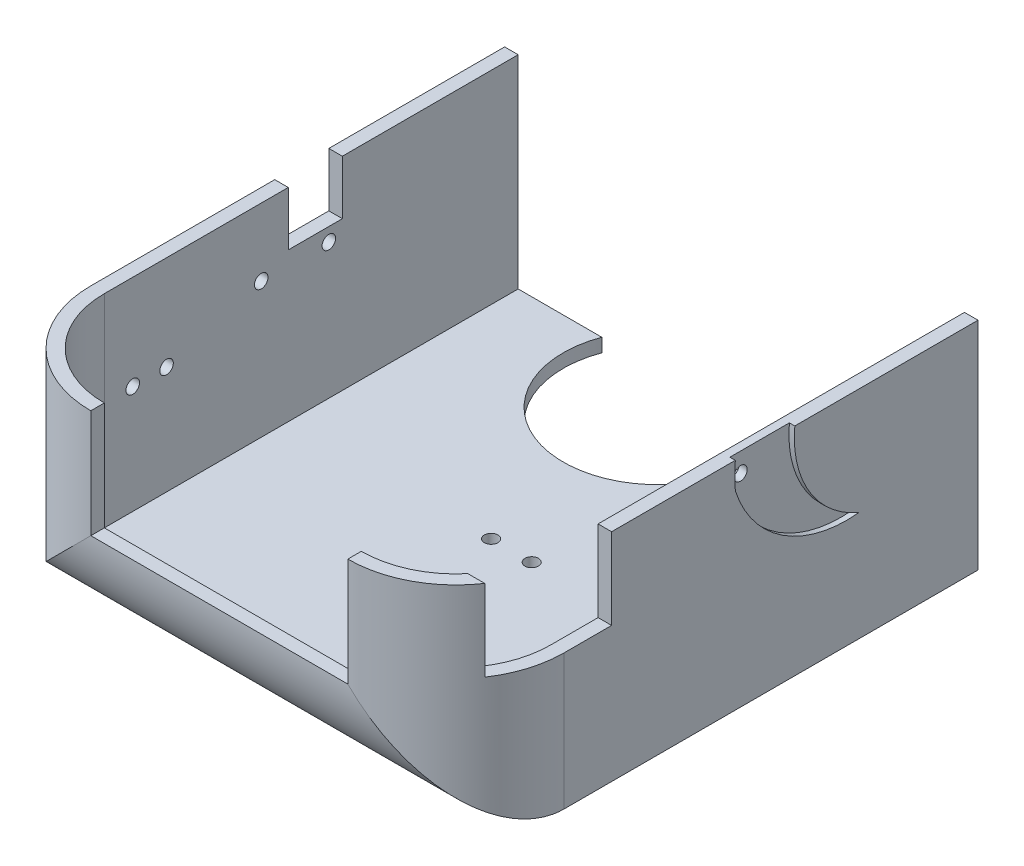
from build123d import *

# Parameters (mm, degrees)
SKETCH_1_W           = 175
SKETCH_1_H           = 160
EXTRUDE_1_DEPTH      = 193
FILLET_8_R           = 40
SHELL_2_T            = -5
SKETCH_9_W           = 95
SKETCH_9_H           = 80
CUT_EXTRUDE_3_DEPTH  = 10
SKETCH_10_R          = 35
CUT_EXTRUDE_4_DEPTH  = 160
SKETCH_12_W          = 40
SKETCH_12_H          = 60
CUT_EXTRUDE_5_DEPTH  = 20
CUT_EXTRUDE_6_DEPTH  = 80
SKETCH_15_R          = 2.5
CUT_EXTRUDE_8_DEPTH  = 5
SKETCH_17_R          = 2.5
SKETCH_17_W          = 20
SKETCH_17_H          = 20
CUT_EXTRUDE_10_DEPTH = 5
CUT_EXTRUDE_11_DEPTH = 2
SKETCH_20_R          = 2.5
CUT_EXTRUDE_13_DEPTH = 5


with BuildPart() as part:
    # 草圖1 → 填料-伸長1 (new body)
    with BuildSketch(Plane.XY):
        Rectangle(SKETCH_1_W, SKETCH_1_H)
    extrude(amount=EXTRUDE_1_DEPTH)

    # 圓角8
    fillet_8_edges = [part.edges().sort_by_distance(p)[0] for p in [
        (-87.5, 0, 193),
        (0, -80, 193),
        (87.5, 0, 193),
        (0, 80, 193),
    ]]
    fillet(fillet_8_edges, radius=FILLET_8_R)

    # 薄殼2
    shell_2_openings = [part.faces().sort_by_distance(p)[0] for p in [
        (0, 0, 0),
    ]]
    offset(amount=SHELL_2_T, openings=shell_2_openings)

    # 草圖9 → 除料-伸長3 (cut)
    with BuildSketch(Plane.XY.offset(193)):
        Rectangle(SKETCH_9_W, SKETCH_9_H)
    extrude(amount=-CUT_EXTRUDE_3_DEPTH, mode=Mode.SUBTRACT)

    # 草圖10 → 除料-伸長4 (cut)
    with BuildSketch(Plane(origin=(0, 80, 0), x_dir=(1, 0, 0), z_dir=(0, 1, 0))):
        with Locations((-18.75, -12.103072957)):
            Circle(SKETCH_10_R)
    extrude(amount=-CUT_EXTRUDE_4_DEPTH, mode=Mode.SUBTRACT)

    # 草圖12 → 除料-伸長5 (cut)
    with BuildSketch(Plane(origin=(90, 0, 0), x_dir=(0, 0, -1), z_dir=(1, 0, 0))):
        with Locations((-155.457670656, 0)):
            Rectangle(SKETCH_12_W, SKETCH_12_H)
    extrude(amount=-CUT_EXTRUDE_5_DEPTH, mode=Mode.SUBTRACT)

    # 草圖4 → 除料-伸長6 (cut)
    with BuildSketch(Plane(origin=(0, 0, 0), x_dir=(1, 0, 0), z_dir=(0, 1, 0))):
        Polygon((0, -200), (-165, -200), (-165, 0), (110, 0), (110, -200), align=None)
    extrude(amount=CUT_EXTRUDE_6_DEPTH, mode=Mode.SUBTRACT)

    # 草圖15 → 除料-伸長8 (cut)
    with BuildSketch(Plane(origin=(0, -80, 0), x_dir=(1, 0, 0), z_dir=(0, 1, 0))):
        with Locations(Location((-7.5, -85, 0), (0, 0, 270))):
            Circle(SKETCH_15_R)
        with Locations(Location((7.5, -85, 0), (0, 0, 270))):
            Circle(SKETCH_15_R)
    extrude(amount=CUT_EXTRUDE_8_DEPTH, mode=Mode.SUBTRACT)

    # 草圖17 → 除料-伸長10 (cut)
    with BuildSketch(Plane.ZY.offset(87.5)):
        with Locations((130, -35)):
            Circle(SKETCH_17_R)
        with Locations((142.5, -35)):
            Circle(SKETCH_17_R)
        with Locations((70, -25)):
            Circle(SKETCH_17_R)
        with Locations((95, -25)):
            Circle(SKETCH_17_R)
        with Locations((75, -10)):
            Rectangle(SKETCH_17_W, SKETCH_17_H)
    extrude(amount=-CUT_EXTRUDE_10_DEPTH, mode=Mode.SUBTRACT)

    # 草圖18 → 除料-伸長11 (cut)
    with BuildSketch(Plane(origin=(87.5, 0, 0), x_dir=(0, 0, -1), z_dir=(1, 0, 0))):
        with BuildLine():
            Line((-89.728835328, 0), (-67.728835328, 0))
            ThreePointArc((-67.728835328, 0), (-62.3717018, -23.697451199), (-43.97726554, -39.569211896))
            ThreePointArc((-43.97726554, -39.569211896), (-72.150234213, -32.803686073), (-89.728835328, -9.771506706))
            Line((-89.728835328, -9.771506706), (-89.893994181, -4.771506706))
            Line((-89.893994181, -4.771506706), (-89.728835328, 0))
        make_face()
    extrude(amount=-CUT_EXTRUDE_11_DEPTH, mode=Mode.SUBTRACT)

    # 草圖20 → 除料-伸長13 (cut)
    with BuildSketch(Plane(origin=(85.5, 0, 0), x_dir=(0, 0, -1), z_dir=(1, 0, 0))):
        with Locations((-85.811414754, -7.139379624)):
            Circle(SKETCH_20_R)
    extrude(amount=-CUT_EXTRUDE_13_DEPTH, mode=Mode.SUBTRACT)


solid = part.part
